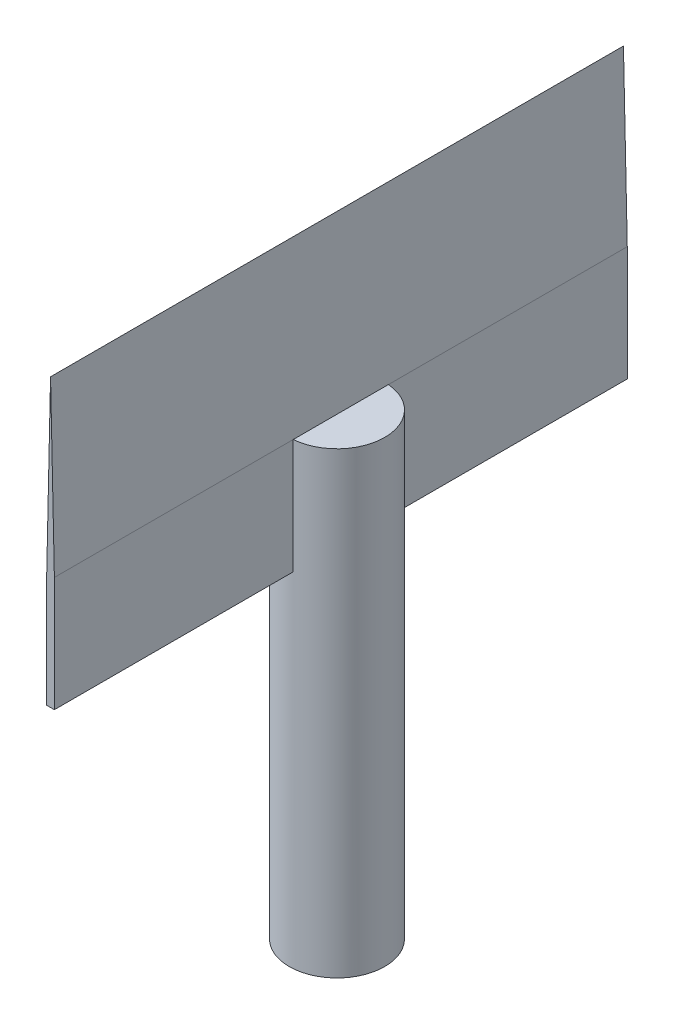
from build123d import *

# Parameters (mm, degrees)
SKETCH2_R           = 12.5
SKETCH2_R_2         = 10
BOSS_EXTRUDE3_DEPTH = 90
SKETCH3_R           = 12.5
BOSS_EXTRUDE4_DEPTH = 30
BOSS_EXTRUDE5_DEPTH = 75


with BuildPart() as part:
    # Sketch2 → Boss-Extrude3 (new body)
    with BuildSketch(Plane(origin=(0, 0, 0), x_dir=(1, 0, 0), z_dir=(0, 1, 0))):
        with Locations(Location((0, 0, 0), (0, 0, 90))):
            Circle(SKETCH2_R)
        with Locations(Location((0, 0, 0), (0, 0, 90))):
            Circle(SKETCH2_R_2, mode=Mode.SUBTRACT)
    extrude(amount=BOSS_EXTRUDE3_DEPTH)

    # Sketch3 → Boss-Extrude4 (add)
    with BuildSketch(Plane(origin=(0, 90, 0), x_dir=(1, 0, 0), z_dir=(0, 1, 0))):
        with Locations(Location((0, 0, 0), (0, 0, 90))):
            Circle(SKETCH3_R)
    extrude(amount=BOSS_EXTRUDE4_DEPTH)

    # Sketch5 → Boss-Extrude5 (add, symmetric)
    with BuildSketch(Plane.XY):
        Polygon((-1, 90), (1, 90), (1, 120), (0, 165), (-1, 120), align=None)
    extrude(amount=BOSS_EXTRUDE5_DEPTH, both=True)


solid = part.part
